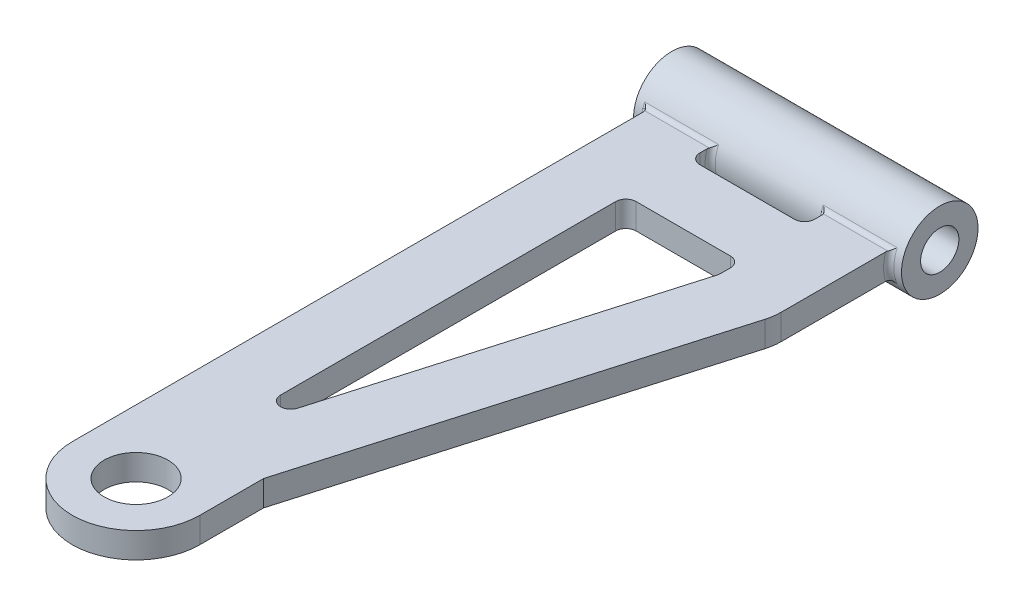
from build123d import *

# Parameters (mm, degrees)
SKETCH_1_R      = 15
SKETCH_1_R_2    = 7.5
EXTRUDE_1_DEPTH = 52.5
SKETCH_2_R      = 12.5
EXTRUDE_2_DEPTH = 5
FILLET_1_R      = 4
FILLET_2_R      = 20
FILLET_3_R      = 2


with BuildPart() as part:
    # 스케치1 → 보스-돌출1 (new, symmetric)
    with BuildSketch(Plane(origin=(0, 0, 0), x_dir=(0, 0, -1), z_dir=(1, 0, 0))):
        Circle(SKETCH_1_R)
        Circle(SKETCH_1_R_2, mode=Mode.SUBTRACT)
    extrude(amount=EXTRUDE_1_DEPTH, both=True)

    # 스케치2 → 보스-돌출2 (add, symmetric)
    with BuildSketch(Plane(origin=(0, 0, 0), x_dir=(1, 0, 0), z_dir=(0, 1, 0))):
        with BuildLine():
            Line((-47.5, -12), (-47.5, -240))
            ThreePointArc((-47.5, -240), (-22.5, -265), (2.5, -240))
            Line((2.5, -240), (2.5, -215))
            Line((2.5, -215), (47.5, -60))
            Line((47.5, -60), (47.5, -12))
            Line((47.5, -12), (22.5, -12))
            Line((22.5, -12), (22.5, -23))
            Line((22.5, -23), (-22.5, -23))
            Line((-22.5, -23), (-22.5, -12))
            Line((-22.5, -12), (-47.5, -12))
        make_face()
        with Locations(Location((-22.5, -240, 0), (0, 0, 270))):
            Circle(SKETCH_2_R, mode=Mode.SUBTRACT)
        with BuildLine():
            Line((-14.658615093, -184.435160923), (22.5, -56.444375602))
            Line((22.5, -56.444375602), (22.5, -48))
            Line((22.5, -48), (-22.5, -48))
            Line((-22.5, -48), (-22.5, -183.319920143))
            ThreePointArc((-22.5, -183.319920143), (-19.063231911, -187.280067844), (-14.658615093, -184.435160923))
        make_face(mode=Mode.SUBTRACT)
    extrude(amount=EXTRUDE_2_DEPTH, both=True)

    # 필렛1
    fillet_1_edges = [part.edges().sort_by_distance(p)[0] for p in [
        (22.5, 0, 23),
        (-22.5, 0, 23),
        (22.5, 0, 48),
        (-22.5, 0, 48),
        (22.5, 0, 56.444375602),
    ]]
    fillet(fillet_1_edges, radius=FILLET_1_R)

    # 필렛2
    fillet_2_edges = [part.edges().sort_by_distance(p)[0] for p in [
        (47.5, 0, 60),
    ]]
    fillet(fillet_2_edges, radius=FILLET_2_R)

    # 필렛3
    fillet_3_edges = [part.edges().sort_by_distance(p)[0] for p in [
        (-47.5, 0, 15),
        (-35, -5, 14.142135624),
        (-35, 5, 14.142135624),
        (-22.5, 0, 15),
        (22.5, 0, 15),
        (35, -5, 14.142135624),
        (35, 5, 14.142135624),
        (47.5, 0, 15),
    ]]
    fillet(fillet_3_edges, radius=FILLET_3_R)


solid = part.part
